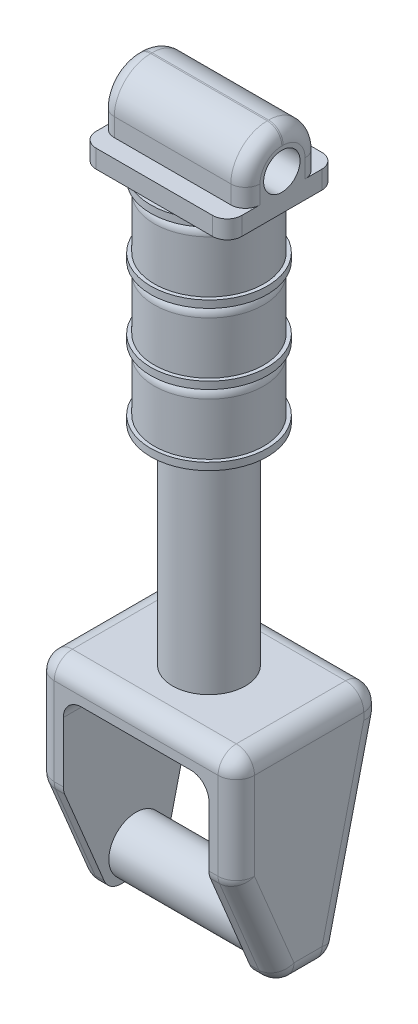
from build123d import *

# Parameters (mm, degrees)
BOSS_EXTRUDE1_DEPTH       = 101.6
SKETCH2_R                 = 19.05
BOSS_EXTRUDE2_DEPTH       = 120.65
CUT_EXTRUDE1_REACH        = 263.894
FILLET1_R                 = 12.7
FILLET2_R                 = 12.7
SKETCH5_R                 = 25.4
BOSS_EXTRUDE3_DEPTH       = 146.05
SKETCH6_R                 = 40.64
BOSS_EXTRUDE4_DEPTH       = 5.08
SKETCH7_R                 = 38.1
BOSS_EXTRUDE5_DEPTH       = 43.942
FILLET5_R                 = 7.62
SKETCH8_R                 = 40.64
BOSS_EXTRUDE6_DEPTH       = 5.08
SKETCH9_R                 = 38.1
BOSS_EXTRUDE7_DEPTH       = 43.942
FILLET6_R                 = 7.62
SKETCH10_R                = 40.64
BOSS_EXTRUDE8_DEPTH       = 5.08
SKETCH11_R                = 38.1
BOSS_EXTRUDE9_DEPTH       = 43.942
FILLET7_R                 = 7.62
SKETCH12_R                = 40.64
BOSS_EXTRUDE10_DEPTH      = 5.08
BOSS_EXTRUDE11_DEPTH      = 50.8
BOSS_EXTRUDE11_DEPTH_BACK = 50.8
SKETCH13_R                = 12.7
FILLET3_R                 = 10.16
FILLET4_R                 = 10.16


with BuildPart() as part:
    # Sketch1 → Boss-Extrude1 (new body)
    with BuildSketch(Plane.XY):
        Polygon((-50.8, -196.85), (-69.85, -196.85), (-69.85, -44.45), (69.85, -44.45), (69.85, -196.85), (50.8, -196.85), (50.8, -63.5), (-50.8, -63.5), align=None)
    extrude(amount=-BOSS_EXTRUDE1_DEPTH)

    # Sketch2 → Boss-Extrude2 (add)
    with BuildSketch(Plane(origin=(69.85, 0, 0), x_dir=(0, 0, -1), z_dir=(1, 0, 0))):
        with Locations(Location((50.8, -177.8, 0), (0, 0, 270))):
            Circle(SKETCH2_R)
    extrude(amount=-BOSS_EXTRUDE2_DEPTH)

    # Cut-Extrude1: up to this face of the body (flat: up to its plane)
    cut_extrude1_end = Plane(part.part.faces().sort_by_distance((-69.85, -120.65, -50.8))[0])
    # Sketch4 → Cut-Extrude1 (cut, up to the picked face)
    with BuildSketch(Plane(origin=(69.85, 0, 0), x_dir=(0, 0, -1), z_dir=(1, 0, 0)), mode=Mode.PRIVATE) as cut_extrude1_sk1:
        Polygon((0, -196.85), (31.75, -196.85), (0, -120.65), align=None)
    cut_extrude1_tool1 = split(extrude(cut_extrude1_sk1.sketch, amount=-CUT_EXTRUDE1_REACH, mode=Mode.PRIVATE), bisect_by=cut_extrude1_end, keep=Keep.BOTH, mode=Mode.PRIVATE)
    # Sketch4 → Cut-Extrude1 (cut, up to the picked face)
    with BuildSketch(Plane(origin=(69.85, 0, 0), x_dir=(0, 0, -1), z_dir=(1, 0, 0)), mode=Mode.PRIVATE) as cut_extrude1_sk2:
        Polygon((101.6, -63.5), (69.85, -196.85), (101.6, -196.85), align=None)
    cut_extrude1_tool2 = split(extrude(cut_extrude1_sk2.sketch, amount=-CUT_EXTRUDE1_REACH, mode=Mode.PRIVATE), bisect_by=cut_extrude1_end, keep=Keep.BOTH, mode=Mode.PRIVATE)
    add(cut_extrude1_tool1.solids().sort_by(Axis((69.85, -171.45, -10.583333), (-1, 0, 0)))[0], mode=Mode.SUBTRACT)
    add(cut_extrude1_tool2.solids().sort_by(Axis((69.85, -152.4, -91.016667), (-1, 0, 0)))[0], mode=Mode.SUBTRACT)

    # Fillet1
    fillet1_edges = [part.edges().sort_by_distance(p)[0] for p in [
        (50.8, -63.5, -50.8),
        (-50.8, -63.5, -50.8),
        (0, -44.45, -101.6),
        (60.325, -120.65, 0),
        (-60.325, -120.65, 0),
        (-60.325, -196.85, -31.75),
        (60.325, -196.85, -31.75),
        (-60.325, -196.85, -69.85),
        (60.325, -196.85, -69.85),
        (0, -44.45, 0),
    ]]
    fillet(fillet1_edges, radius=FILLET1_R)

    # Fillet2
    fillet2_edges = [part.edges().sort_by_distance(p)[0] for p in [
        (69.85, -48.169743879, -3.719743879),
        (69.85, -60.325, -101.6),
        (-69.85, -87.63, 0),
        (69.85, -87.63, 0),
        (-69.85, -156.014615385, -14.73525641),
        (-69.85, -44.45, -50.8),
        (-69.85, -60.325, -101.6),
        (-69.85, -125.295790348, -86.886716584),
        (-69.85, -196.85, -50.017730454),
        (-69.85, -120.600674916, -0.246625419),
        (-69.85, -194.717038738, -33.171974175),
        (-69.85, -194.116144562, -67.69064044),
        (-69.85, -48.169743879, -97.880256121),
        (-69.85, -48.169743879, -3.719743879),
        (69.85, -44.45, -50.8),
        (69.85, -156.014615385, -14.73525641),
        (69.85, -196.85, -50.017730454),
        (69.85, -125.295790348, -86.886716584),
        (69.85, -120.600674916, -0.246625419),
        (69.85, -194.116144562, -67.69064044),
        (69.85, -194.717038738, -33.171974175),
        (69.85, -48.169743879, -97.880256121),
    ]]
    fillet(fillet2_edges, radius=FILLET2_R)

    # Sketch5 → Boss-Extrude3 (add)
    with BuildSketch(Plane(origin=(0, -44.45, 0), x_dir=(1, 0, 0), z_dir=(0, 1, 0))):
        with Locations(Location((0, 50.8, 0), (0, 0, 270))):
            Circle(SKETCH5_R)
    extrude(amount=BOSS_EXTRUDE3_DEPTH)

    # Sketch6 → Boss-Extrude4 (add)
    with BuildSketch(Plane(origin=(0, 101.6, 0), x_dir=(1, 0, 0), z_dir=(0, 1, 0))):
        with Locations(Location((0, 50.8, 0), (0, 0, 270))):
            Circle(SKETCH6_R)
    extrude(amount=BOSS_EXTRUDE4_DEPTH)

    # Sketch7 → Boss-Extrude5 (add)
    with BuildSketch(Plane(origin=(0, 106.68, 0), x_dir=(1, 0, 0), z_dir=(0, 1, 0))):
        with Locations(Location((0, 50.8, 0), (0, 0, 90))):
            Circle(SKETCH7_R)
    extrude(amount=BOSS_EXTRUDE5_DEPTH)

    # Fillet5
    fillet5_edges = [part.edges().sort_by_distance(p)[0] for p in [
        (0, 150.622, -12.7),
    ]]
    fillet(fillet5_edges, radius=FILLET5_R)

    # Sketch8 → Boss-Extrude6 (add)
    with BuildSketch(Plane(origin=(0, 150.622, 0), x_dir=(1, 0, 0), z_dir=(0, 1, 0))):
        with Locations(Location((0, 50.8, 0), (0, 0, 270))):
            Circle(SKETCH8_R)
    extrude(amount=BOSS_EXTRUDE6_DEPTH)

    # Sketch9 → Boss-Extrude7 (add)
    with BuildSketch(Plane(origin=(0, 155.702, 0), x_dir=(1, 0, 0), z_dir=(0, 1, 0))):
        with Locations(Location((0, 50.8, 0), (0, 0, 90))):
            Circle(SKETCH9_R)
    extrude(amount=BOSS_EXTRUDE7_DEPTH)

    # Fillet6
    fillet6_edges = [part.edges().sort_by_distance(p)[0] for p in [
        (0, 199.644, -12.7),
    ]]
    fillet(fillet6_edges, radius=FILLET6_R)

    # Sketch10 → Boss-Extrude8 (add)
    with BuildSketch(Plane(origin=(0, 199.644, 0), x_dir=(1, 0, 0), z_dir=(0, 1, 0))):
        with Locations(Location((0, 50.8, 0), (0, 0, 270))):
            Circle(SKETCH10_R)
    extrude(amount=BOSS_EXTRUDE8_DEPTH)

    # Sketch11 → Boss-Extrude9 (add)
    with BuildSketch(Plane(origin=(0, 204.724, 0), x_dir=(1, 0, 0), z_dir=(0, 1, 0))):
        with Locations(Location((0, 50.8, 0), (0, 0, 90))):
            Circle(SKETCH11_R)
    extrude(amount=BOSS_EXTRUDE9_DEPTH)

    # Fillet7
    fillet7_edges = [part.edges().sort_by_distance(p)[0] for p in [
        (0, 248.666, -12.7),
    ]]
    fillet(fillet7_edges, radius=FILLET7_R)

    # Sketch12 → Boss-Extrude10 (add)
    with BuildSketch(Plane(origin=(0, 248.666, 0), x_dir=(1, 0, 0), z_dir=(0, 1, 0))):
        with Locations(Location((0, 50.8, 0), (0, 0, 270))):
            Circle(SKETCH12_R)
    extrude(amount=BOSS_EXTRUDE10_DEPTH)

    # Sketch13 → Boss-Extrude11 (add, two sides: drawn at the far end of the back side and taken through both)
    with BuildSketch(Plane(origin=(0, 0, 0), x_dir=(0, 0, -1), z_dir=(1, 0, 0)).offset(-BOSS_EXTRUDE11_DEPTH_BACK)):
        with BuildLine():
            Line((50.8, 253.746), (12.7, 253.746))
            Line((12.7, 253.746), (12.7, 266.446))
            Line((12.7, 266.446), (25.4, 266.446))
            Line((25.4, 266.446), (25.4, 279.146))
            ThreePointArc((25.4, 279.146), (32.839487758, 297.106512242), (50.8, 304.546))
            Line((50.8, 304.546), (51.778264307, 304.546))
            ThreePointArc((51.778264307, 304.546), (69.738776549, 297.106512242), (77.178264307, 279.146))
            Line((77.178264307, 279.146), (77.178264307, 266.446))
            Line((77.178264307, 266.446), (88.9, 266.446))
            Line((88.9, 266.446), (88.9, 253.746))
            Line((88.9, 253.746), (50.8, 253.746))
        make_face()
        with Locations((50.8, 279.146)):
            Circle(SKETCH13_R, mode=Mode.SUBTRACT)
    extrude(amount=BOSS_EXTRUDE11_DEPTH + BOSS_EXTRUDE11_DEPTH_BACK)

    # Fillet3
    fillet3_edges = [part.edges().sort_by_distance(p)[0] for p in [
        (-50.8, 260.096, -12.7),
        (-50.8, 260.096, -88.9),
        (50.8, 260.096, -88.9),
        (50.8, 260.096, -12.7),
    ]]
    fillet(fillet3_edges, radius=FILLET3_R)

    # Fillet4
    fillet4_edges = [part.edges().sort_by_distance(p)[0] for p in [
        (-50.8, 272.796, -25.4),
        (-50.8, 297.106512242, -32.839487758),
        (-50.8, 304.546, -51.289132154),
        (-50.8, 297.106512242, -69.738776549),
        (-50.8, 272.796, -77.178264307),
        (50.8, 272.796, -77.178264307),
        (50.8, 297.106512242, -69.738776549),
        (50.8, 304.546, -51.289132154),
        (50.8, 297.106512242, -32.839487758),
        (50.8, 272.796, -25.4),
    ]]
    fillet(fillet4_edges, radius=FILLET4_R)


solid = part.part
